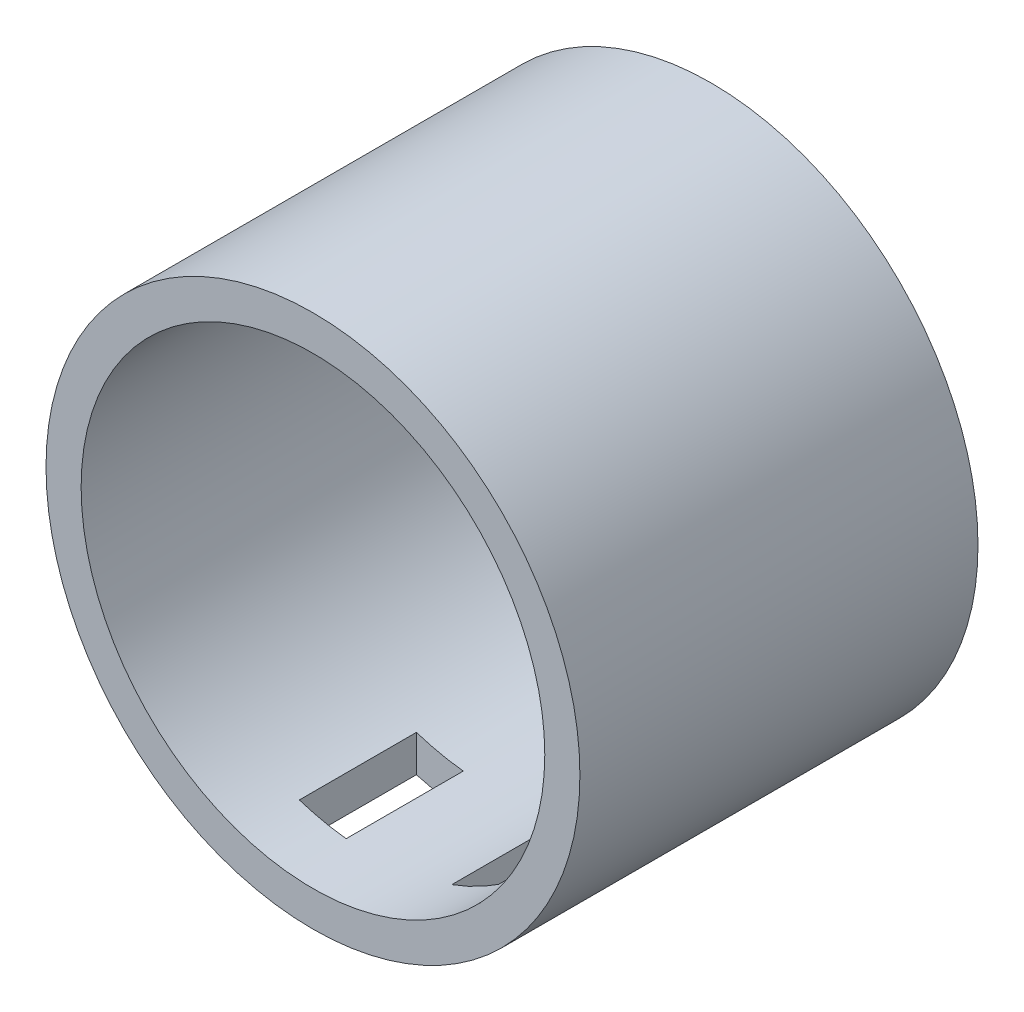
from build123d import *

# Parameters (mm, degrees)
ESQUISSE1_R             = 11.4
ESQUISSE1_R_2           = 9.9
BOSS_EXTRU_1_DEPTH      = 15
BOSS_EXTRU_2_START      = 2
ESQUISSE2_R             = 11.4
ESQUISSE2_R_2           = 2.5
BOSS_EXTRU_2_DEPTH      = 2
ESQUISSE3_W             = 2
ESQUISSE3_H             = 5
ENL_V_MAT_EXTRU_1_DEPTH = 21


with BuildPart() as part:
    # Esquisse1 → Boss.-Extru.1 (new body)
    with BuildSketch(Plane.XY):
        Circle(ESQUISSE1_R)
        Circle(ESQUISSE1_R_2, mode=Mode.SUBTRACT)
    extrude(amount=BOSS_EXTRU_1_DEPTH)

    # Esquisse2 → Boss.-Extru.2 (add)
    with BuildSketch(Plane(origin=(0, 0, 0), x_dir=(-1, 0, 0), z_dir=(0, 0, -1)).offset(BOSS_EXTRU_2_START)):
        Circle(ESQUISSE2_R)
        Circle(ESQUISSE2_R_2, mode=Mode.SUBTRACT)
    extrude(amount=-BOSS_EXTRU_2_DEPTH)

    # Esquisse3 → Enlèv. mat.-Extru.1 (cut)
    with BuildSketch(Plane(origin=(0, 0, 0), x_dir=(1, 0, 0), z_dir=(0, 1, 0))):
        with Locations((4.431290854, -10.002963211)):
            Rectangle(ESQUISSE3_W, ESQUISSE3_H)
        with Locations((-2.078658243, -10.002963211)):
            Rectangle(ESQUISSE3_W, ESQUISSE3_H)
    extrude(amount=-ENL_V_MAT_EXTRU_1_DEPTH, mode=Mode.SUBTRACT)


solid = part.part
